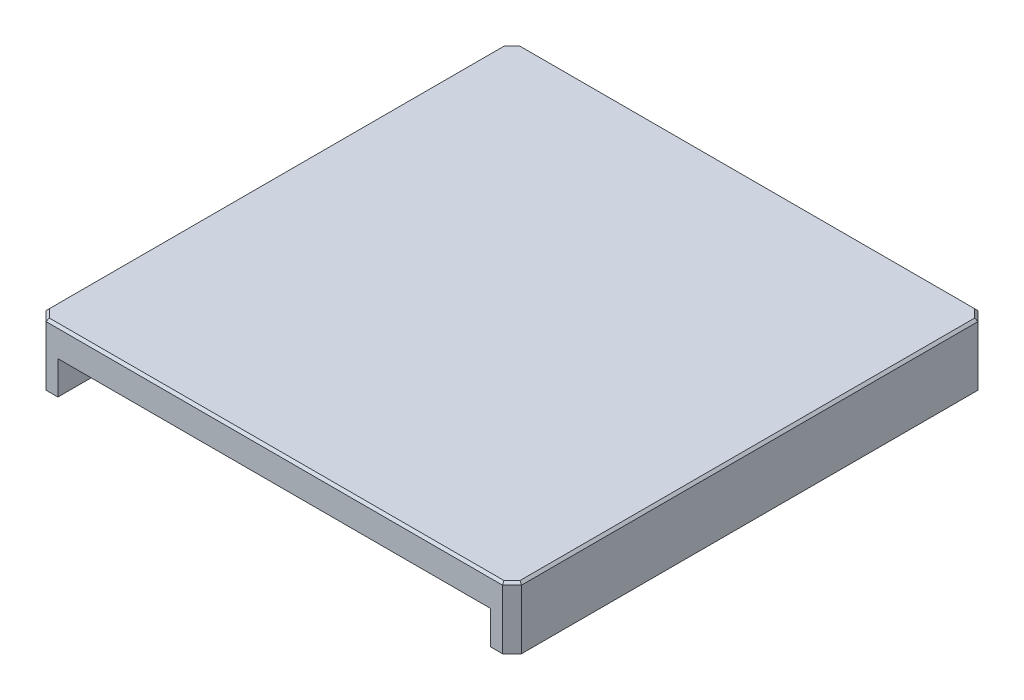
from build123d import *

# Parameters (mm, degrees)
BOSS_EXTRUDE1_DEPTH = 100
CHAMFER1_SIZE       = 2
CHAMFER2_SIZE       = 0.5


with BuildPart() as part:
    # Sketch1 → Boss-Extrude1 (new body)
    with BuildSketch(Plane.XY):
        Polygon((50, 0), (50, 13), (-50, 13), (-50, 0), (-45.5, 0), (-45.5, 7), (45.5, 7), (45.5, 0), align=None)
    extrude(amount=BOSS_EXTRUDE1_DEPTH)

    # Chamfer1
    chamfer1_edges = [part.edges().sort_by_distance(p)[0] for p in [
        (-50, 6.5, 0),
        (50, 6.5, 100),
        (50, 6.5, 0),
        (-50, 6.5, 100),
    ]]
    chamfer(chamfer1_edges, length=CHAMFER1_SIZE)

    # Chamfer2
    chamfer2_edges = [part.edges().sort_by_distance(p)[0] for p in [
        (-50, 13, 50),
        (0, 13, 0),
        (0, 13, 100),
        (50, 13, 50),
        (-49, 13, 99),
        (49, 13, 99),
        (49, 13, 1),
        (-49, 13, 1),
    ]]
    chamfer(chamfer2_edges, length=CHAMFER2_SIZE)


solid = part.part
